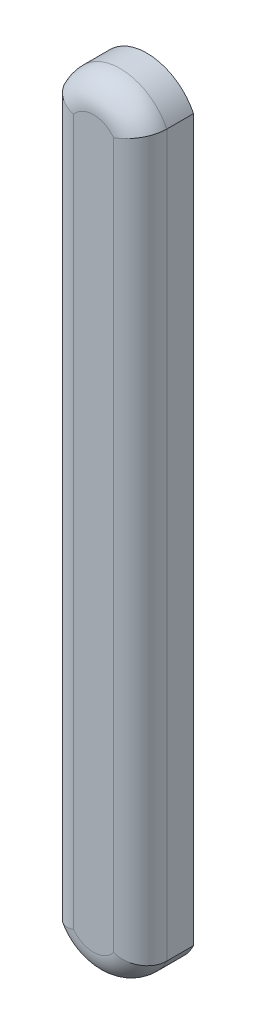
from build123d import *

# Parameters (mm, degrees)
BOSS_EXTRU_1_DEPTH = 0.2
CONG_1_R           = 0.1


with BuildPart() as part:
    # Esquisse1 → Boss.-Extru.1 (new body)
    with BuildSketch(Plane.XY):
        with BuildLine():
            Line((0, 0), (0, 2.7))
            ThreePointArc((0, 2.7), (0.175, 2.809006611), (0.35, 2.7))
            Line((0.35, 2.7), (0.35, 0))
            ThreePointArc((0.35, 0), (0.175, -0.109006611), (0, 0))
        make_face()
    extrude(amount=BOSS_EXTRU_1_DEPTH)

    # Congé1
    cong_1_edges = [part.edges().sort_by_distance(p)[0] for p in [
        (0.175, 2.809006611, 0.2),
        (0, 1.35, 0.2),
        (0.175, -0.109006611, 0.2),
        (0.35, 1.35, 0.2),
    ]]
    fillet(cong_1_edges, radius=CONG_1_R)


solid = part.part
